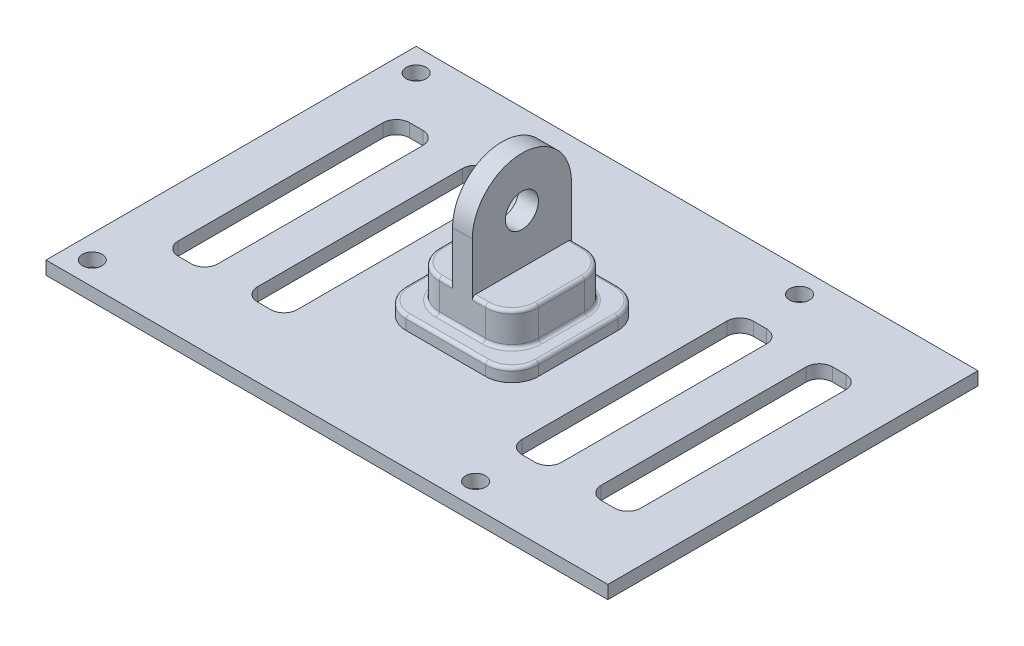
from build123d import *

# Parameters (mm, degrees)
SKETCH1_W           = 85
SKETCH1_H           = 56
BOSS_EXTRUDE1_DEPTH = 2
SKETCH2_R           = 1.5
CUT_EXTRUDE2_DEPTH  = 2
SKETCH3_W           = 20
SKETCH3_H           = 20
BOSS_EXTRUDE2_DEPTH = 2
SKETCH4_W           = 15
SKETCH4_H           = 15
BOSS_EXTRUDE3_DEPTH = 5
SKETCH5_W           = 3
SKETCH5_H           = 15
BOSS_EXTRUDE4_DEPTH = 15
CUT_EXTRUDE3_DEPTH  = 15
CUT_EXTRUDE4_DEPTH  = 15
SKETCH9_R           = 2.5
CUT_EXTRUDE5_DEPTH  = 15
FILLET1_R           = 4
FILLET2_R           = 0.5
FILLET3_R           = 0.5
CUT_EXTRUDE6_DEPTH  = 15


with BuildPart() as part:
    # Sketch1 → Boss-Extrude1 (new body)
    with BuildSketch(Plane(origin=(0, 0, 0), x_dir=(1, 0, 0), z_dir=(0, 1, 0))):
        Rectangle(SKETCH1_W, SKETCH1_H)
    extrude(amount=BOSS_EXTRUDE1_DEPTH)

    # Sketch2 → Cut-Extrude2 (cut)
    with BuildSketch(Plane(origin=(0, 0, 0), x_dir=(1, 0, 0), z_dir=(0, 1, 0))):
        with Locations(Location((-39, -24.5, 0), (0, 0, 270))):
            Circle(SKETCH2_R)
        with Locations(Location((-39, 24.5, 0), (0, 0, 270))):
            Circle(SKETCH2_R)
        with Locations(Location((19, 24.5, 0), (0, 0, 270))):
            Circle(SKETCH2_R)
        with Locations(Location((19, -24.5, 0), (0, 0, 270))):
            Circle(SKETCH2_R)
    extrude(amount=CUT_EXTRUDE2_DEPTH, mode=Mode.SUBTRACT)

    # Sketch3 → Boss-Extrude2 (add)
    with BuildSketch(Plane(origin=(0, 2, 0), x_dir=(1, 0, 0), z_dir=(0, 1, 0))):
        Rectangle(SKETCH3_W, SKETCH3_H)
    extrude(amount=BOSS_EXTRUDE2_DEPTH)

    # Sketch4 → Boss-Extrude3 (add)
    with BuildSketch(Plane(origin=(0, 4, 0), x_dir=(1, 0, 0), z_dir=(0, 1, 0))):
        Rectangle(SKETCH4_W, SKETCH4_H)
    extrude(amount=BOSS_EXTRUDE3_DEPTH)

    # Sketch5 → Boss-Extrude4 (add)
    with BuildSketch(Plane(origin=(0, 9, 0), x_dir=(1, 0, 0), z_dir=(0, 1, 0))):
        Rectangle(SKETCH5_W, SKETCH5_H)
    extrude(amount=BOSS_EXTRUDE4_DEPTH)

    # Sketch7 → Cut-Extrude3 (cut)
    with BuildSketch(Plane.ZY.offset(1.5)):
        with BuildLine():
            Line((-7.5, 16.5), (-7.5, 24))
            Line((-7.5, 24), (0, 24))
            ThreePointArc((0, 24), (-5.303300859, 21.803300859), (-7.5, 16.5))
        make_face()
    extrude(amount=-CUT_EXTRUDE3_DEPTH, mode=Mode.SUBTRACT)

    # Sketch8 → Cut-Extrude4 (cut)
    with BuildSketch(Plane.ZY.offset(1.5)):
        with BuildLine():
            Line((7.5, 16.5), (7.5, 24))
            Line((7.5, 24), (0, 24))
            ThreePointArc((0, 24), (5.303300859, 21.803300859), (7.5, 16.5))
        make_face()
    extrude(amount=-CUT_EXTRUDE4_DEPTH, mode=Mode.SUBTRACT)

    # Sketch9 → Cut-Extrude5 (cut)
    with BuildSketch(Plane.ZY.offset(1.5)):
        with Locations((0, 16.5)):
            Circle(SKETCH9_R)
    extrude(amount=-CUT_EXTRUDE5_DEPTH, mode=Mode.SUBTRACT)

    # Fillet1
    fillet1_edges = [part.edges().sort_by_distance(p)[0] for p in [
        (10, 3, 10),
        (10, 3, -10),
        (-10, 3, -10),
        (-10, 3, 10),
        (7.5, 6.5, 7.5),
        (7.5, 6.5, -7.5),
        (-7.5, 6.5, -7.5),
        (-7.5, 6.5, 7.5),
    ]]
    fillet(fillet1_edges, radius=FILLET1_R)

    # Fillet2
    fillet2_edges = [part.edges().sort_by_distance(p)[0] for p in [
        (7.5, 4, 0),
        (0, 4, 7.5),
        (-7.5, 4, 0),
        (0, 4, -7.5),
        (10, 4, 0),
        (0, 4, 10),
        (0, 4, -10),
        (-10, 4, 0),
        (8.828427125, 4, -8.828427125),
        (-8.828427125, 4, -8.828427125),
        (-8.828427125, 4, 8.828427125),
        (8.828427125, 4, 8.828427125),
        (6.328427125, 4, 6.328427125),
        (-6.328427125, 4, 6.328427125),
        (-6.328427125, 4, -6.328427125),
        (6.328427125, 4, -6.328427125),
    ]]
    fillet(fillet2_edges, radius=FILLET2_R)

    # Fillet3
    fillet3_edges = [part.edges().sort_by_distance(p)[0] for p in [
        (7.5, 9, 0),
        (-2.5, 9, 7.5),
        (2.5, 9, -7.5),
        (6.328427125, 9, -6.328427125),
        (6.328427125, 9, 6.328427125),
        (-7.5, 9, 0),
        (-6.328427125, 9, -6.328427125),
        (-6.328427125, 9, 6.328427125),
        (-2.5, 9, -7.5),
        (2.5, 9, 7.5),
    ]]
    fillet(fillet3_edges, radius=FILLET3_R)

    # Sketch10 → Cut-Extrude6 (cut)
    with BuildSketch(Plane(origin=(0, 2, 0), x_dir=(1, 0, 0), z_dir=(0, 1, 0))):
        with BuildLine():
            Line((-21, -17.5), (-19, -17.5))
            ThreePointArc((-19, -17.5), (-17.585786438, -16.914213562), (-17, -15.5))
            Line((-17, -15.5), (-17, 15.5))
            ThreePointArc((-17, 15.5), (-17.585786438, 16.914213562), (-19, 17.5))
            Line((-19, 17.5), (-21, 17.5))
            ThreePointArc((-21, 17.5), (-22.414213562, 16.914213562), (-23, 15.5))
            Line((-23, 15.5), (-23, -15.5))
            ThreePointArc((-23, -15.5), (-22.414213562, -16.914213562), (-21, -17.5))
        make_face()
        with BuildLine():
            Line((-35, -15.5), (-35, 15.5))
            ThreePointArc((-35, 15.5), (-34.414213562, 16.914213562), (-33, 17.5))
            Line((-33, 17.5), (-31, 17.5))
            ThreePointArc((-31, 17.5), (-29.585786438, 16.914213562), (-29, 15.5))
            Line((-29, 15.5), (-29, -15.5))
            ThreePointArc((-29, -15.5), (-29.585786438, -16.914213562), (-31, -17.5))
            Line((-31, -17.5), (-33, -17.5))
            ThreePointArc((-33, -17.5), (-34.414213562, -16.914213562), (-35, -15.5))
        make_face()
        with BuildLine():
            Line((33, -17.5), (31, -17.5))
            ThreePointArc((31, -17.5), (29.585786438, -16.914213562), (29, -15.5))
            Line((29, -15.5), (29, 15.5))
            ThreePointArc((29, 15.5), (29.585786438, 16.914213562), (31, 17.5))
            Line((31, 17.5), (33, 17.5))
            ThreePointArc((33, 17.5), (34.414213562, 16.914213562), (35, 15.5))
            Line((35, 15.5), (35, -15.5))
            ThreePointArc((35, -15.5), (34.414213562, -16.914213562), (33, -17.5))
        make_face()
        with BuildLine():
            Line((21, 17.5), (19, 17.5))
            ThreePointArc((19, 17.5), (17.585786438, 16.914213562), (17, 15.5))
            Line((17, 15.5), (17, -15.5))
            ThreePointArc((17, -15.5), (17.585786438, -16.914213562), (19, -17.5))
            Line((19, -17.5), (21, -17.5))
            ThreePointArc((21, -17.5), (22.414213562, -16.914213562), (23, -15.5))
            Line((23, -15.5), (23, 15.5))
            ThreePointArc((23, 15.5), (22.414213562, 16.914213562), (21, 17.5))
        make_face()
    extrude(amount=-CUT_EXTRUDE6_DEPTH, mode=Mode.SUBTRACT)


solid = part.part
